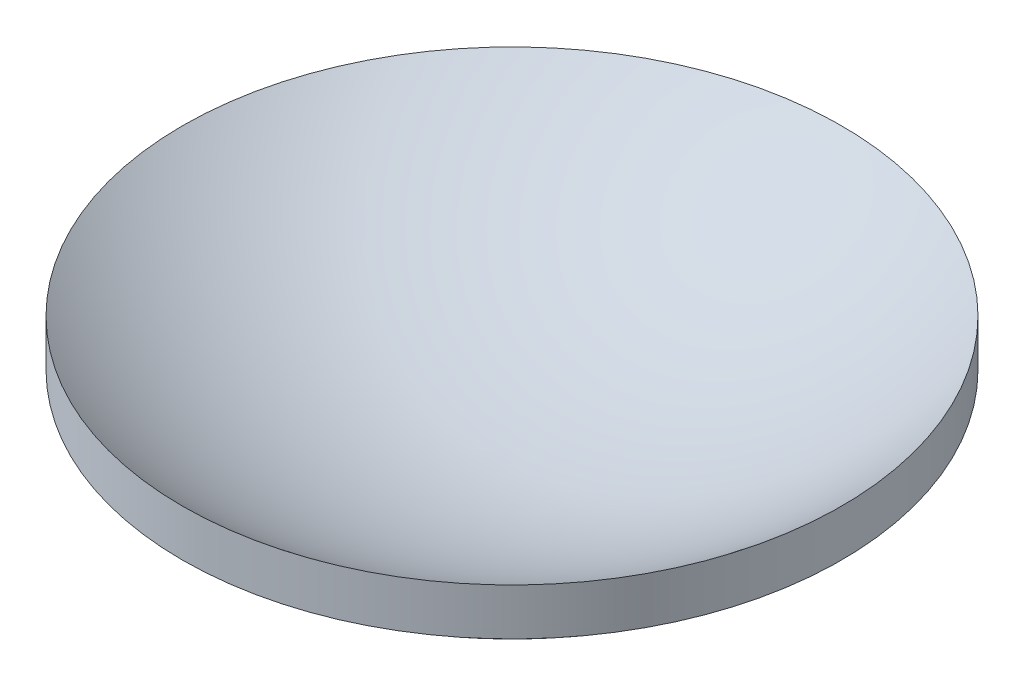
from build123d import *


with BuildPart() as part:
    # Sketch1 → Revolve1 (revolve)
    with BuildSketch(Plane.XY):
        with BuildLine():
            Line((-4500, -6000), (-4500, -5361.902647382))
            ThreePointArc((-4500, -5361.902647382), (-2394.439544896, -6577.739677567), (0, -7000))
            Line((0, -7000), (0, -7500))
            ThreePointArc((0, -7500), (-2371.708245126, -7115.124735379), (-4500, -6000))
        make_face()
    revolve(axis=Axis((0, 0, 0), (0, -1, 0)))


solid = part.part
